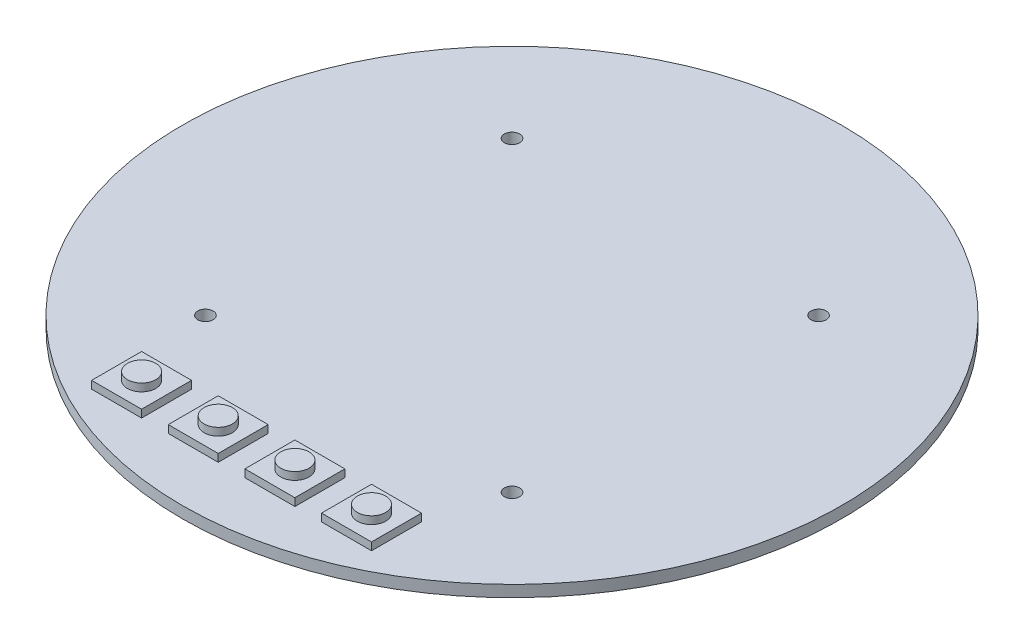
from build123d import *

# Parameters (mm, degrees)
SKETCH_1_R             = 43
SKETCH_1_R_2           = 1
EXTRUDE_1_DEPTH        = 0.75
SKETCH_3_W             = 6.520751419
SKETCH_3_H             = 6.52075142
SKETCH_3_R             = 1.848339335
EXTRUDE_2_DEPTH        = 1
SKETCH_3_3_R           = 1.848339335
EXTRUDE_3_DEPTH        = 2
PATTERN_LINEAR_1_COUNT = 4
PATTERN_LINEAR_1_PITCH = 10


with BuildPart() as part:
    # 草图1 → 凸台-拉伸1 (new, symmetric)
    with BuildSketch(Plane(origin=(0, 0, 0), x_dir=(1, 0, 0), z_dir=(0, 1, 0))):
        Circle(SKETCH_1_R)
        with Locations((-20, 20)):
            Circle(SKETCH_1_R_2, mode=Mode.SUBTRACT)
        with Locations((-20, -20)):
            Circle(SKETCH_1_R_2, mode=Mode.SUBTRACT)
        with Locations((20, -20)):
            Circle(SKETCH_1_R_2, mode=Mode.SUBTRACT)
        with Locations((20, 20)):
            Circle(SKETCH_1_R_2, mode=Mode.SUBTRACT)
    extrude(amount=EXTRUDE_1_DEPTH, both=True)

    # 草图3 → 凸台-拉伸2 (add)
    with BuildSketch(Plane(origin=(0, 0.75, 0), x_dir=(1, 0, 0), z_dir=(0, 1, 0))):
        with Locations((-15.822411534, -32.507863696)):
            Rectangle(SKETCH_3_W, SKETCH_3_H)
        with Locations((-15.822411533, -32.507863696)):
            Circle(SKETCH_3_R, mode=Mode.SUBTRACT)
    extrude_2 = extrude(amount=EXTRUDE_2_DEPTH)

    # 草图3<3> → 凸台-拉伸3 (add)
    with BuildSketch(Plane(origin=(0, 0.75, 0), x_dir=(1, 0, 0), z_dir=(0, 1, 0))):
        with Locations((-15.822411533, -32.507863696)):
            Circle(SKETCH_3_3_R)
    extrude_3 = extrude(amount=EXTRUDE_3_DEPTH)

    # 阵列(线性)1: 凸台-拉伸2, 凸台-拉伸3 ×4
    with Locations(*[(i * PATTERN_LINEAR_1_PITCH, 0, 0) for i in range(1, PATTERN_LINEAR_1_COUNT)]):
        add(extrude_2)
        add(extrude_3)


solid = part.part
